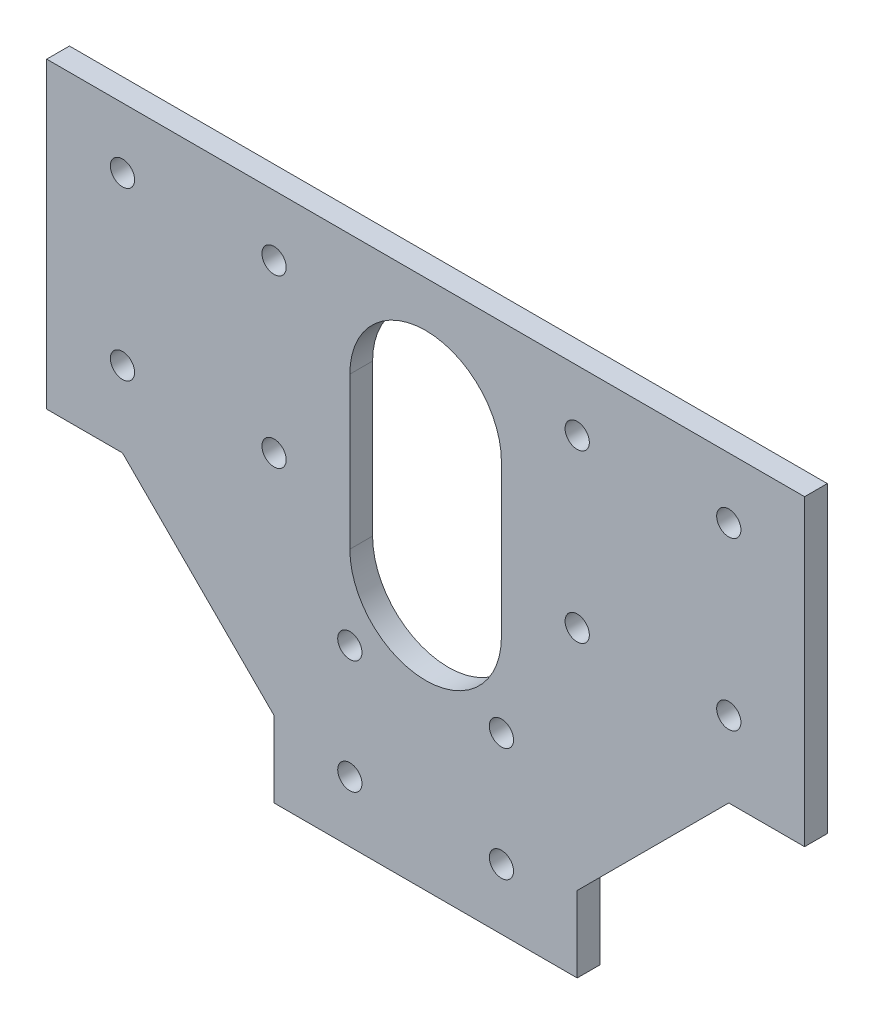
from build123d import *

# Parameters (mm, degrees)
EXTRUDE_1_DEPTH     = 3
SKETCH_2_R          = 1.6
CUT_EXTRUDE_1_DEPTH = 3
CUT_EXTRUDE_2_DEPTH = 81.678373806


with BuildPart() as part:
    # 草图1 → 凸台-拉伸1 (new body)
    with BuildSketch(Plane.XY):
        Polygon((-20, 0), (-30, 0), (-30, 40), (70, 40), (70, 0), (60, 0), (40, -20), (40, -30), (0, -30), (0, -20), align=None)
    extrude(amount=EXTRUDE_1_DEPTH)

    # 草图2 → 切除-拉伸1 (cut)
    with BuildSketch(Plane.XY.offset(3)):
        with Locations((10, -7)):
            Circle(SKETCH_2_R)
        with Locations((30, -7)):
            Circle(SKETCH_2_R)
        with Locations((10, -22)):
            Circle(SKETCH_2_R)
        with Locations((30, -22)):
            Circle(SKETCH_2_R)
        with Locations((-20, 10)):
            Circle(SKETCH_2_R)
        with Locations((-20, 32)):
            Circle(SKETCH_2_R)
        with Locations((0, 10)):
            Circle(SKETCH_2_R)
        with Locations((40, 10)):
            Circle(SKETCH_2_R)
        with Locations((60, 10)):
            Circle(SKETCH_2_R)
        with Locations((60, 32)):
            Circle(SKETCH_2_R)
        with Locations((40, 32)):
            Circle(SKETCH_2_R)
        with Locations((0, 32)):
            Circle(SKETCH_2_R)
    extrude(amount=-CUT_EXTRUDE_1_DEPTH, mode=Mode.SUBTRACT)

    # 草图3 → 切除-拉伸2 (cut, through all)
    with BuildSketch(Plane.XY.offset(3)):
        with BuildLine():
            Line((30, 24), (30, 4))
            ThreePointArc((30, 4), (20, -6), (10, 4))
            Line((10, 4), (10, 24))
            ThreePointArc((10, 24), (20, 34), (30, 24))
        make_face()
    extrude(amount=-CUT_EXTRUDE_2_DEPTH, mode=Mode.SUBTRACT)


solid = part.part
